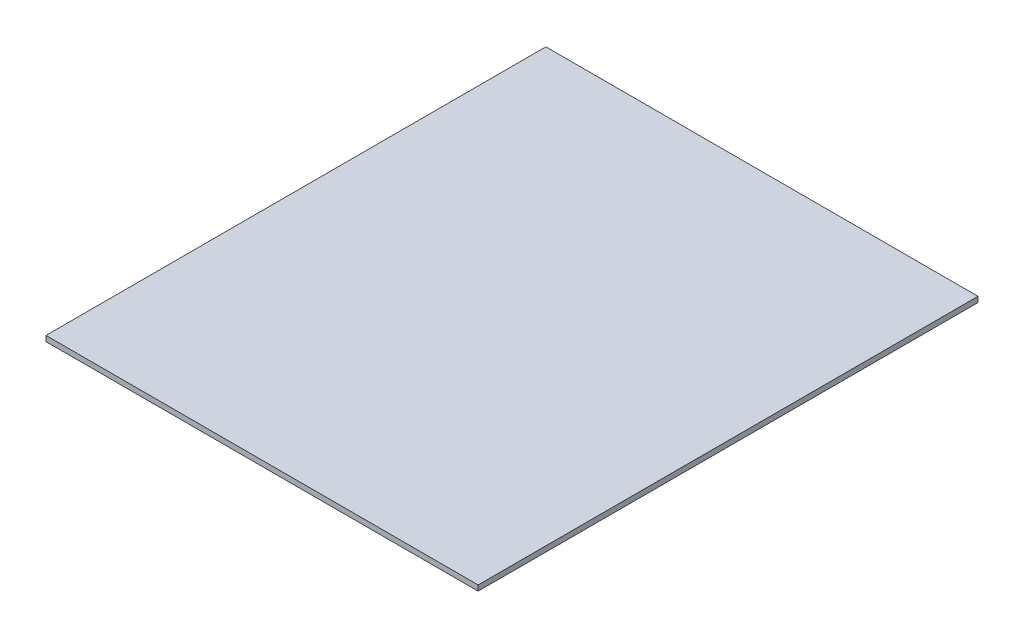
from build123d import *

# Parameters (mm, degrees)
SKETCH1_W           = 506.4125
SKETCH1_H           = 585.7875
BOSS_EXTRUDE1_DEPTH = 6.35


with BuildPart() as part:
    # Sketch1 → Boss-Extrude1 (new body)
    with BuildSketch(Plane(origin=(0, 0, 0), x_dir=(1, 0, 0), z_dir=(0, 1, 0))):
        Rectangle(SKETCH1_W, SKETCH1_H)
    extrude(amount=BOSS_EXTRUDE1_DEPTH)


solid = part.part
